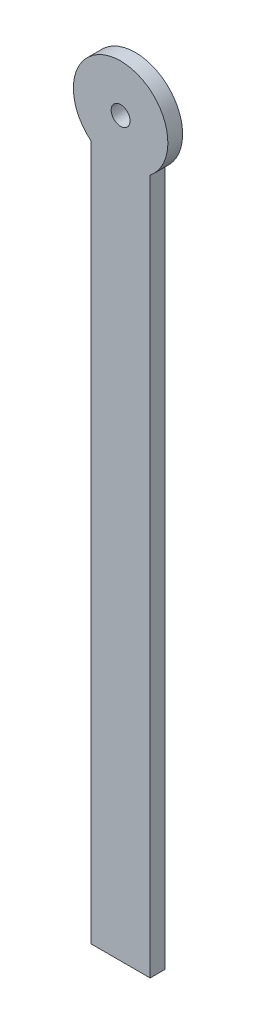
from build123d import *

# Parameters (mm, degrees)
SKETCH1_W           = 12.7
SKETCH1_H           = 165.1
BOSS_EXTRUDE1_DEPTH = 3.175
SKETCH3_R           = 10.16
BOSS_EXTRUDE2_DEPTH = 3.175
SKETCH4_R           = 2.032
CUT_EXTRUDE2_DEPTH  = 168.977605129


with BuildPart() as part:
    # Sketch1 → Boss-Extrude1 (new body)
    with BuildSketch(Plane.XY):
        with Locations((0, 82.55)):
            Rectangle(SKETCH1_W, SKETCH1_H)
    extrude(amount=BOSS_EXTRUDE1_DEPTH)

    # Sketch3 → Boss-Extrude2 (add)
    with BuildSketch(Plane.XY.offset(3.175)):
        with Locations((0, 157.48)):
            Circle(SKETCH3_R)
    extrude(amount=-BOSS_EXTRUDE2_DEPTH)

    # Sketch4 → Cut-Extrude2 (cut, through all)
    with BuildSketch(Plane.XY.offset(3.175)):
        with Locations((0, 157.48)):
            Circle(SKETCH4_R)
    extrude(amount=-CUT_EXTRUDE2_DEPTH, mode=Mode.SUBTRACT)


solid = part.part
